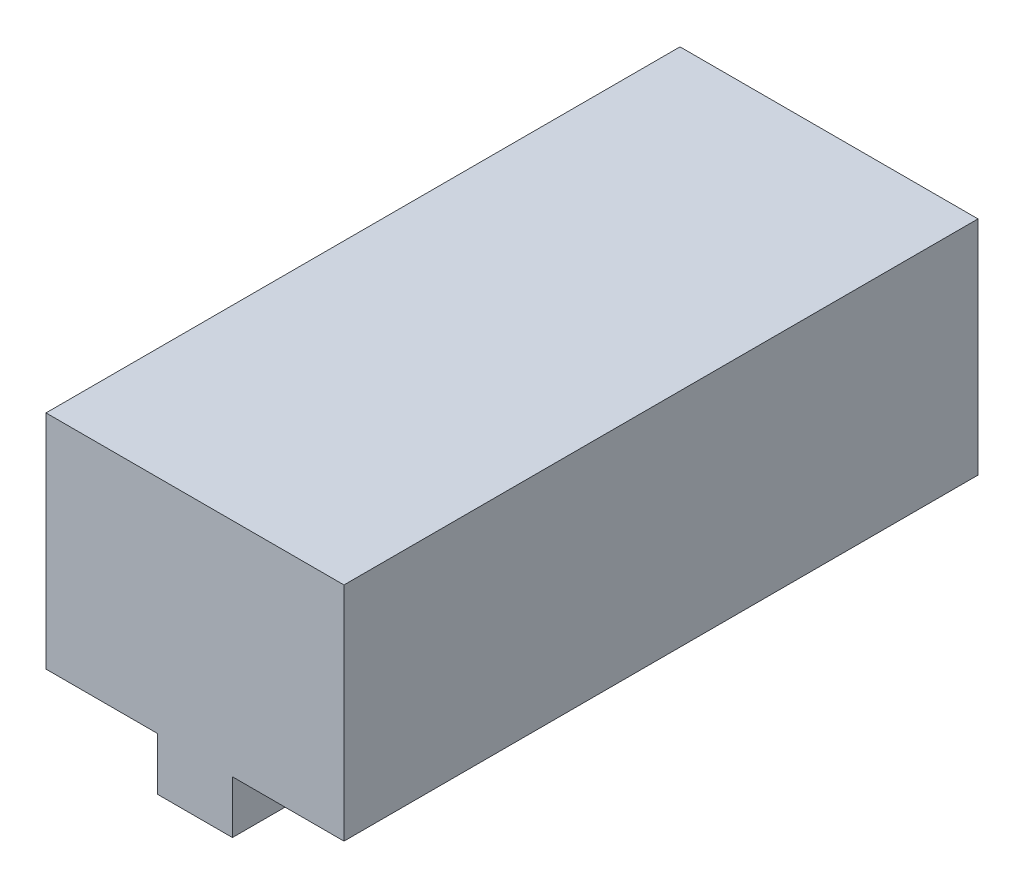
from build123d import *

# Parameters (mm, degrees)
SKETCH1_W           = 11.938
SKETCH1_H           = 8.89
BOSS_EXTRUDE1_DEPTH = 25.4
SKETCH2_W           = 3
SKETCH2_H           = 2.11
BOSS_EXTRUDE2_DEPTH = 15


with BuildPart() as part:
    # Sketch1 → Boss-Extrude1 (new body)
    with BuildSketch(Plane.XY):
        with Locations((5.969, 4.445)):
            Rectangle(SKETCH1_W, SKETCH1_H)
    extrude(amount=-BOSS_EXTRUDE1_DEPTH)

    # Sketch2 → Boss-Extrude2 (add)
    with BuildSketch(Plane.XY):
        with Locations((5.969, -1.055)):
            Rectangle(SKETCH2_W, SKETCH2_H)
    extrude(amount=-BOSS_EXTRUDE2_DEPTH)


solid = part.part
